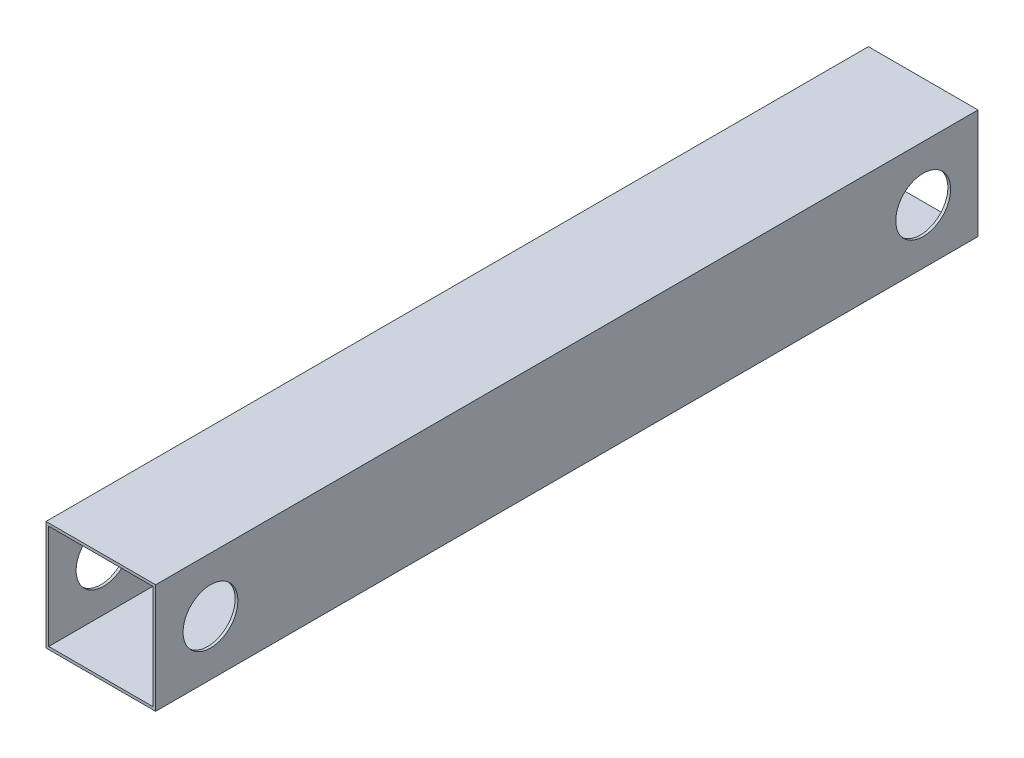
from build123d import *

# Parameters (mm, degrees)
SKETCH1_W           = 20
SKETCH1_H           = 20
SKETCH1_W_2         = 19
SKETCH1_H_2         = 19
BOSS_EXTRUDE1_DEPTH = 150
SKETCH2_R           = 5
CUT_EXTRUDE1_DEPTH  = 150


with BuildPart() as part:
    # Sketch1 → Boss-Extrude1 (new body)
    with BuildSketch(Plane.XY):
        Rectangle(SKETCH1_W, SKETCH1_H)
        Rectangle(SKETCH1_W_2, SKETCH1_H_2, mode=Mode.SUBTRACT)
    extrude(amount=BOSS_EXTRUDE1_DEPTH)

    # Sketch2 → Cut-Extrude1 (cut)
    with BuildSketch(Plane(origin=(10, 0, 0), x_dir=(0, 0, -1), z_dir=(1, 0, 0))):
        with Locations((-140, 0)):
            Circle(SKETCH2_R)
        with Locations((-10, 0)):
            Circle(SKETCH2_R)
    extrude(amount=-CUT_EXTRUDE1_DEPTH, mode=Mode.SUBTRACT)


solid = part.part
